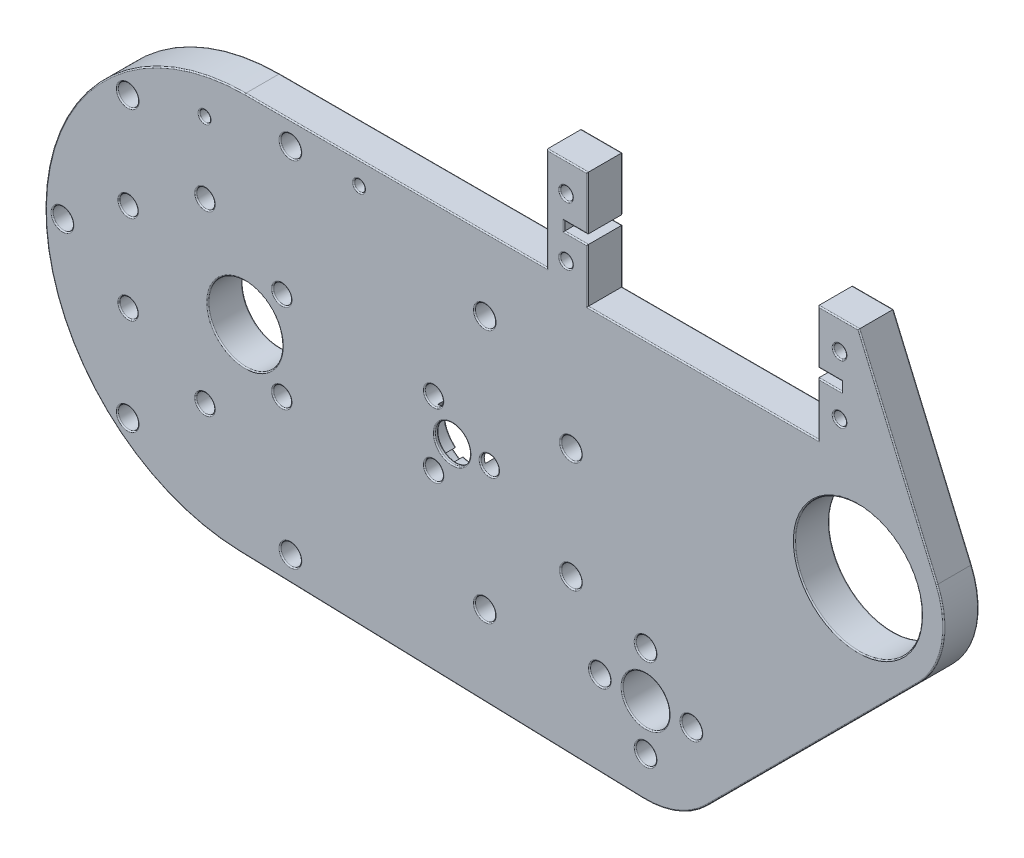
from build123d import *

# Parameters (mm, degrees)
SKETCH_1_R          = 6.5
SKETCH_1_R_2        = 1.6
EXTRUDE_1_DEPTH     = 8
SKETCH_2_R          = 9
CUT_EXTRUDE_1_DEPTH = 3
EXTRUDE_2_DEPTH     = 29.8
SKETCH_3_R          = 1.8
SKETCH_3_R_2        = 4.1
SKETCH_3_R_3        = 11.1
EXTRUDE_3_DEPTH     = 5.55
CUT_EXTRUDE_2_DEPTH = 0.8
SKETCH_6_R          = 5.15
CUT_EXTRUDE_3_DEPTH = 3.2
SKETCH_7_R          = 3.1
CUT_EXTRUDE_4_DEPTH = 97.47904643
SKETCH_8_R          = 2.85
CUT_EXTRUDE_5_DEPTH = 1
SKETCH_9_R          = 1.8
CUT_EXTRUDE_6_DEPTH = 98.940014294
SKETCH_11_R         = 11.1
SKETCH_11_R_2       = 1.8
SKETCH_11_R_3       = 4.1
EXTRUDE_5_DEPTH     = 1.35
SKETCH_12_W         = 189.522571926
SKETCH_12_H         = 105.391425854
CUT_EXTRUDE_7_DEPTH = 97.31020922
SKETCH_15_R         = 1.1
EXTRUDE_6_DEPTH     = 6.1
SKETCH_16_R         = 0.95
CUT_EXTRUDE_8_DEPTH = 102.068462215
FILLET_1_R          = 0.2


with BuildPart() as part:
    # 스케치1 → 보스-돌출1 (new body)
    with BuildSketch(Plane.XY):
        with BuildLine():
            Line((-29.014917127, 27.992580876), (4.947513812, 19.275168147))
            ThreePointArc((4.947513812, 19.275168147), (19.9, 0), (4.947513812, -19.275168147))
            Line((4.947513812, -19.275168147), (-29.014917127, -27.992580876))
            ThreePointArc((-29.014917127, -27.992580876), (-65.1, 0), (-29.014917127, 27.992580876))
        make_face()
        with Locations((-36.2, 0)):
            Circle(SKETCH_1_R, mode=Mode.SUBTRACT)
        with Locations((-43.2, -15.5)):
            Circle(SKETCH_1_R_2, mode=Mode.SUBTRACT)
        with Locations((-56.623393759, -7.75)):
            Circle(SKETCH_1_R_2, mode=Mode.SUBTRACT)
        with Locations((-56.623393759, 7.75)):
            Circle(SKETCH_1_R_2, mode=Mode.SUBTRACT)
        with Locations((-43.2, 15.5)):
            Circle(SKETCH_1_R_2, mode=Mode.SUBTRACT)
        with Locations((-29.776606241, 7.75)):
            Circle(SKETCH_1_R_2, mode=Mode.SUBTRACT)
        with Locations((-29.776606241, -7.75)):
            Circle(SKETCH_1_R_2, mode=Mode.SUBTRACT)
        with Locations((6.5, 0)):
            Circle(SKETCH_1_R_2, mode=Mode.SUBTRACT)
        with Locations((-3.25, -5.629165125)):
            Circle(SKETCH_1_R_2, mode=Mode.SUBTRACT)
        with Locations((-3.25, 5.629165125)):
            Circle(SKETCH_1_R_2, mode=Mode.SUBTRACT)
    extrude(amount=EXTRUDE_1_DEPTH)

    # 스케치2 → 컷-돌출1 (cut)
    with BuildSketch(Plane(origin=(0, 0, 0), x_dir=(-1, 0, 0), z_dir=(0, 0, -1))):
        Circle(SKETCH_2_R)
    extrude(amount=-CUT_EXTRUDE_1_DEPTH, mode=Mode.SUBTRACT)

    # 스케치1<3> → 보스-돌출2 (add)
    with BuildSketch(Plane.XY):
        with BuildLine():
            Line((-27.52320442, 33.804189363), (6.439226519, 25.086776633))
            ThreePointArc((6.439226519, 25.086776633), (25.9, 0), (6.439226519, -25.086776633))
            Line((6.439226519, -25.086776633), (-27.52320442, -33.804189363))
            ThreePointArc((-27.52320442, -33.804189363), (-71.1, 0), (-27.52320442, 33.804189363))
        make_face()
        with BuildLine():
            ThreePointArc((-29.014917127, 27.992580876), (-65.1, 0), (-29.014917127, -27.992580876))
            Line((-29.014917127, -27.992580876), (4.947513812, -19.275168147))
            ThreePointArc((4.947513812, -19.275168147), (19.9, 0), (4.947513812, 19.275168147))
            Line((4.947513812, 19.275168147), (-29.014917127, 27.992580876))
        make_face(mode=Mode.SUBTRACT)
    extrude(amount=EXTRUDE_2_DEPTH)

    # 스케치3 → 보스-돌출3 (add)
    with BuildSketch(Plane(origin=(0, 0, 0), x_dir=(-1, 0, 0), z_dir=(0, 0, -1))):
        with BuildLine():
            ThreePointArc((-44.406601718, -32.606601718), (-39.332686639, -35.942359146), (-33.352102124, -36.993311425))
            Line((-33.352102124, -36.993311425), (37.242109059, -34.884437916))
            ThreePointArc((37.242109059, -34.884437916), (32.344634414, -34.686397279), (27.52320442, -33.804189363))
            Line((27.52320442, -33.804189363), (-6.439226519, -25.086776633))
            ThreePointArc((-6.439226519, -25.086776633), (-25.9, 0), (-6.439226519, 25.086776633))
            Line((-6.439226519, 25.086776633), (27.52320442, 33.804189363))
            ThreePointArc((27.52320442, 33.804189363), (31.053060825, 34.518386653), (34.637724346, 34.865015342))
            Line((34.637724346, 34.865015342), (-71.591465181, 30.104963614))
            ThreePointArc((-71.591465181, 30.104963614), (-84.90323111, 20.548558531), (-81.526601718, 4.513398282))
            Line((-81.526601718, 4.513398282), (-44.406601718, -32.606601718))
        make_face()
        with Locations((-33.8, -30)):
            Circle(SKETCH_3_R, mode=Mode.SUBTRACT)
        with Locations((-41.8, -22)):
            Circle(SKETCH_3_R, mode=Mode.SUBTRACT)
        with Locations((-33.8, -22)):
            Circle(SKETCH_3_R_2, mode=Mode.SUBTRACT)
        with Locations((-25.8, -22)):
            Circle(SKETCH_3_R, mode=Mode.SUBTRACT)
        with Locations((-33.8, -14)):
            Circle(SKETCH_3_R, mode=Mode.SUBTRACT)
        with Locations((-70.92, 15.12)):
            Circle(SKETCH_3_R_3, mode=Mode.SUBTRACT)
    extrude(amount=-EXTRUDE_3_DEPTH)

    # 스케치5 → 컷-돌출2 (cut)
    with BuildSketch(Plane(origin=(0, 0, 0), x_dir=(-1, 0, 0), z_dir=(0, 0, -1))):
        with BuildLine():
            Line((-33.352102124, -36.993311425), (37.242109059, -34.884437916))
            ThreePointArc((37.242109059, -34.884437916), (71.07569642, 1.302228568), (34.637724346, 34.865015342))
            Line((34.637724346, 34.865015342), (-71.591465181, 30.104963614))
            ThreePointArc((-71.591465181, 30.104963614), (-84.90323111, 20.548558531), (-81.526601718, 4.513398282))
            Line((-81.526601718, 4.513398282), (-44.406601718, -32.606601718))
            ThreePointArc((-44.406601718, -32.606601718), (-39.332686639, -35.942359146), (-33.352102124, -36.993311425))
        make_face()
    extrude(amount=-CUT_EXTRUDE_2_DEPTH, mode=Mode.SUBTRACT)

    # 스케치6 → 컷-돌출3 (cut)
    with BuildSketch(Plane(origin=(0, 0, 3), x_dir=(-1, 0, 0), z_dir=(0, 0, -1))):
        Circle(SKETCH_6_R)
    extrude(amount=-CUT_EXTRUDE_3_DEPTH, mode=Mode.SUBTRACT)

    # 스케치7 → 컷-돌출4 (cut, through all)
    with BuildSketch(Plane(origin=(0, 0, 6.2), x_dir=(-1, 0, 0), z_dir=(0, 0, -1))):
        Circle(SKETCH_7_R)
    extrude(amount=-CUT_EXTRUDE_4_DEPTH, mode=Mode.SUBTRACT)

    # 스케치8 → 컷-돌출5 (cut)
    with BuildSketch(Plane.XY.offset(8)):
        with Locations((-3.25, 5.629165125)):
            Circle(SKETCH_8_R)
        with Locations((6.5, 0)):
            Circle(SKETCH_8_R)
        with Locations((-3.25, -5.629165125)):
            Circle(SKETCH_8_R)
    extrude(amount=-CUT_EXTRUDE_5_DEPTH, mode=Mode.SUBTRACT)

    # 스케치9 → 컷-돌출6 (cut, through all)
    with BuildSketch(Plane.XY.offset(29.8)):
        with Locations((-28.269060773, 30.898385119)):
            Circle(SKETCH_9_R)
        with Locations((5.693370166, 22.18097239)):
            Circle(SKETCH_9_R)
        with Locations((5.693370166, -22.18097239)):
            Circle(SKETCH_9_R)
        with Locations((-28.269060773, -30.898385119)):
            Circle(SKETCH_9_R)
        with Locations((-56.704924749, 24.436817735)):
            Circle(SKETCH_9_R)
        with Locations((-68.1, 0)):
            Circle(SKETCH_9_R)
        with Locations((-56.704924749, -24.436817735)):
            Circle(SKETCH_9_R)
        with Locations((20.754448323, 9.677958194)):
            Circle(SKETCH_9_R)
        with Locations((20.754448323, -9.677958194)):
            Circle(SKETCH_9_R)
    extrude(amount=-CUT_EXTRUDE_6_DEPTH, mode=Mode.SUBTRACT)

    # 스케치11 → 보스-돌출5 (add)
    with BuildSketch(Plane.XY.offset(5.55)):
        with BuildLine():
            Line((44.406601718, -32.606601718), (81.526601718, 4.513398282))
            ThreePointArc((81.526601718, 4.513398282), (84.90323111, 20.548558531), (71.591465181, 30.104963614))
            Line((71.591465181, 30.104963614), (-34.637724346, 34.865015342))
            ThreePointArc((-34.637724346, 34.865015342), (-31.053060825, 34.518386653), (-27.52320442, 33.804189363))
            Line((-27.52320442, 33.804189363), (6.439226519, 25.086776633))
            ThreePointArc((6.439226519, 25.086776633), (25.9, 0), (6.439226519, -25.086776633))
            Line((6.439226519, -25.086776633), (-27.52320442, -33.804189363))
            ThreePointArc((-27.52320442, -33.804189363), (-32.344634414, -34.686397279), (-37.242109059, -34.884437916))
            Line((-37.242109059, -34.884437916), (33.352102124, -36.993311425))
            ThreePointArc((33.352102124, -36.993311425), (39.332686639, -35.942359146), (44.406601718, -32.606601718))
        make_face()
        with Locations(Location((70.92, 15.12, 0), (0, 0, 180))):
            Circle(SKETCH_11_R, mode=Mode.SUBTRACT)
        with Locations(Location((33.8, -30, 0), (0, 0, 180))):
            Circle(SKETCH_11_R_2, mode=Mode.SUBTRACT)
        with Locations(Location((41.8, -22, 0), (0, 0, 180))):
            Circle(SKETCH_11_R_2, mode=Mode.SUBTRACT)
        with Locations(Location((25.8, -22, 0), (0, 0, 180))):
            Circle(SKETCH_11_R_2, mode=Mode.SUBTRACT)
        with Locations(Location((33.8, -22, 0), (0, 0, 180))):
            Circle(SKETCH_11_R_3, mode=Mode.SUBTRACT)
        with Locations(Location((33.8, -14, 0), (0, 0, 180))):
            Circle(SKETCH_11_R_2, mode=Mode.SUBTRACT)
    extrude(amount=EXTRUDE_5_DEPTH)

    # 스케치12 → 컷-돌출7 (cut, through all)
    with BuildSketch(Plane.XY.offset(6.9)):
        with Locations((-1.349348337, 1.240872361)):
            Rectangle(SKETCH_12_W, SKETCH_12_H)
    extrude(amount=CUT_EXTRUDE_7_DEPTH, mode=Mode.SUBTRACT)

    # 스케치15 → 보스-돌출6 (add)
    with BuildSketch(Plane(origin=(0, 0, 0.8), x_dir=(-1, 0, 0), z_dir=(0, 0, -1))):
        with BuildLine():
            Line((-63.95, 52.871331122), (-71.05, 52.871331122))
            Line((-71.05, 52.871331122), (-84.705549038, 21.032583))
            ThreePointArc((-84.705549038, 21.032583), (-79.453952046, 27.455787874), (-71.591465181, 30.104963614))
            Line((-71.591465181, 30.104963614), (34.637724346, 34.865015342))
            ThreePointArc((34.637724346, 34.865015342), (35.418666341, 34.891252739), (36.2, 34.9))
            Line((36.2, 34.9), (-16.55, 34.9))
            Line((-16.55, 34.9), (-16.55, 52.871331122))
            Line((-16.55, 52.871331122), (-23.65, 52.871331122))
            Line((-23.65, 52.871331122), (-23.65, 43.521331122))
            Line((-23.65, 43.521331122), (-19.55, 43.521331122))
            Line((-19.55, 43.521331122), (-19.55, 41.921331122))
            Line((-19.55, 41.921331122), (-23.65, 41.921331122))
            Line((-23.65, 41.921331122), (-23.65, 32.571331122))
            Line((-23.65, 32.571331122), (-63.95, 32.571331122))
            Line((-63.95, 32.571331122), (-63.95, 41.921331122))
            Line((-63.95, 41.921331122), (-68.05, 41.921331122))
            Line((-68.05, 41.921331122), (-68.05, 43.521331122))
            Line((-68.05, 43.521331122), (-63.95, 43.521331122))
            Line((-63.95, 43.521331122), (-63.95, 52.871331122))
        make_face()
        with Locations((-67.7, 47.821331122)):
            Circle(SKETCH_15_R, mode=Mode.SUBTRACT)
        with Locations((-19.9, 47.821331122)):
            Circle(SKETCH_15_R, mode=Mode.SUBTRACT)
        with Locations((-19.9, 37.621331122)):
            Circle(SKETCH_15_R, mode=Mode.SUBTRACT)
        with Locations((-67.7, 37.621331122)):
            Circle(SKETCH_15_R, mode=Mode.SUBTRACT)
    extrude(amount=-EXTRUDE_6_DEPTH)

    # 스케치16 → 컷-돌출8 (cut, through all)
    with BuildSketch(Plane.XY.offset(6.9)):
        with Locations((-43.269060773, 27.898385119)):
            Circle(SKETCH_16_R)
        with Locations((-16.269060773, 30.898385119)):
            Circle(SKETCH_16_R)
    extrude(amount=-CUT_EXTRUDE_8_DEPTH, mode=Mode.SUBTRACT)

    # 필렛1
    fillet_1_edges = [part.edges().sort_by_distance(p)[0] for p in [
        (-31.376606241, -7.75, 0.8),
        (-31.376606241, 7.75, 0.8),
        (-44.8, 15.5, 0.8),
        (-58.223393759, 7.75, 0.8),
        (-58.223393759, -7.75, 0.8),
        (-44.8, -15.5, 0.8),
        (-42.7, 0, 0.8),
        (9, 0, 0.8),
        (37.9, -22, 0.8),
        (82.02, 15.12, 0.8),
        (35.6, -14, 0.8),
        (27.6, -22, 0.8),
        (35.6, -30, 0.8),
        (39.332686639, -35.942359146, 0.8),
        (62.966601718, -14.046601718, 0.8),
        (-71.096109262, 0.521112625, 0.8),
        (-1.945003468, -35.938874671, 0.8),
        (43.6, -22, 0.8),
        (-4.396539175, 6.745161505, 3),
        (-4.396539175, -6.745161505, 3),
        (-5.15, 0, 3),
        (2.575, -4.460030829, 3),
        (2.575, 4.460030829, 3),
        (3.1, 0, 6.2),
        (-30.069060773, 30.898385119, 0.8),
        (18.954448323, 9.677958194, 0.8),
        (18.954448323, -9.677958194, 0.8),
        (-58.504924749, -24.436817735, 0.8),
        (-69.9, 0, 0.8),
        (-58.504924749, 24.436817735, 0.8),
        (-30.069060773, -30.898385119, 0.8),
        (3.893370166, -22.18097239, 0.8),
        (3.893370166, 22.18097239, 0.8),
        (39.332686639, -35.942359146, 6.9),
        (62.966601718, -14.046601718, 6.9),
        (85.64973593, 12.285413708, 6.9),
        (-1.945003468, -35.938874671, 6.9),
        (82.02, 15.12, 6.9),
        (35.6, -30, 6.9),
        (43.6, -22, 6.9),
        (27.6, -22, 6.9),
        (37.9, -22, 6.9),
        (35.6, -14, 6.9),
        (-4.85, 5.629165125, 6.9),
        (4.9, 0, 6.9),
        (-4.85, -5.629165125, 6.9),
        (-31.376606241, -7.75, 6.9),
        (-31.376606241, 7.75, 6.9),
        (-44.8, 15.5, 6.9),
        (-58.223393759, 7.75, 6.9),
        (-58.223393759, -7.75, 6.9),
        (-44.8, -15.5, 6.9),
        (-42.7, 0, 6.9),
        (3.1, 0, 6.9),
        (3.893370166, 22.18097239, 6.9),
        (3.893370166, -22.18097239, 6.9),
        (-30.069060773, -30.898385119, 6.9),
        (-58.504924749, 24.436817735, 6.9),
        (-69.9, 0, 6.9),
        (-58.504924749, -24.436817735, 6.9),
        (18.954448323, -9.677958194, 6.9),
        (18.954448323, 9.677958194, 6.9),
        (-30.069060773, 30.898385119, 6.9),
        (-71.096109262, 0.521112625, 6.9),
        (85.64973593, 12.285413708, 0.8),
        (77.877774519, 36.951957061, 6.9),
        (67.5, 52.871331122, 0.8),
        (63.95, 48.196331122, 0.8),
        (66, 43.521331122, 0.8),
        (68.05, 42.721331122, 0.8),
        (66, 41.921331122, 0.8),
        (63.95, 37.246331122, 0.8),
        (43.8, 32.571331122, 0.8),
        (23.65, 37.246331122, 6.9),
        (21.6, 41.921331122, 6.9),
        (19.55, 42.721331122, 6.9),
        (21.6, 43.521331122, 6.9),
        (23.65, 48.196331122, 6.9),
        (20.1, 52.871331122, 0.8),
        (16.55, 43.885665561, 0.8),
        (-9.825, 34.9, 6.9),
        (21, 47.821331122, 0.8),
        (68.8, 47.821331122, 0.8),
        (68.8, 37.621331122, 0.8),
        (21, 37.621331122, 0.8),
        (-9.825, 34.9, 0.8),
        (23.65, 48.196331122, 0.8),
        (21.6, 43.521331122, 0.8),
        (19.55, 42.721331122, 0.8),
        (21.6, 41.921331122, 0.8),
        (23.65, 37.246331122, 0.8),
        (77.877774519, 36.951957061, 0.8),
        (68.8, 47.821331122, 6.9),
        (67.5, 52.871331122, 6.9),
        (63.95, 48.196331122, 6.9),
        (66, 43.521331122, 6.9),
        (68.05, 42.721331122, 6.9),
        (66, 41.921331122, 6.9),
        (63.95, 37.246331122, 6.9),
        (43.8, 32.571331122, 6.9),
        (20.1, 52.871331122, 6.9),
        (16.55, 43.885665561, 6.9),
        (21, 37.621331122, 6.9),
        (68.8, 37.621331122, 6.9),
        (21, 47.821331122, 6.9),
        (-44.219060773, 27.898385119, 0.8),
        (-44.219060773, 27.898385119, 6.9),
        (-17.219060773, 30.898385119, 0.8),
        (-17.219060773, 30.898385119, 6.9),
        (9, 0, 3),
        (6.893211628, -1.550930242, 3),
    ]]
    fillet(fillet_1_edges, radius=FILLET_1_R)


solid = part.part
